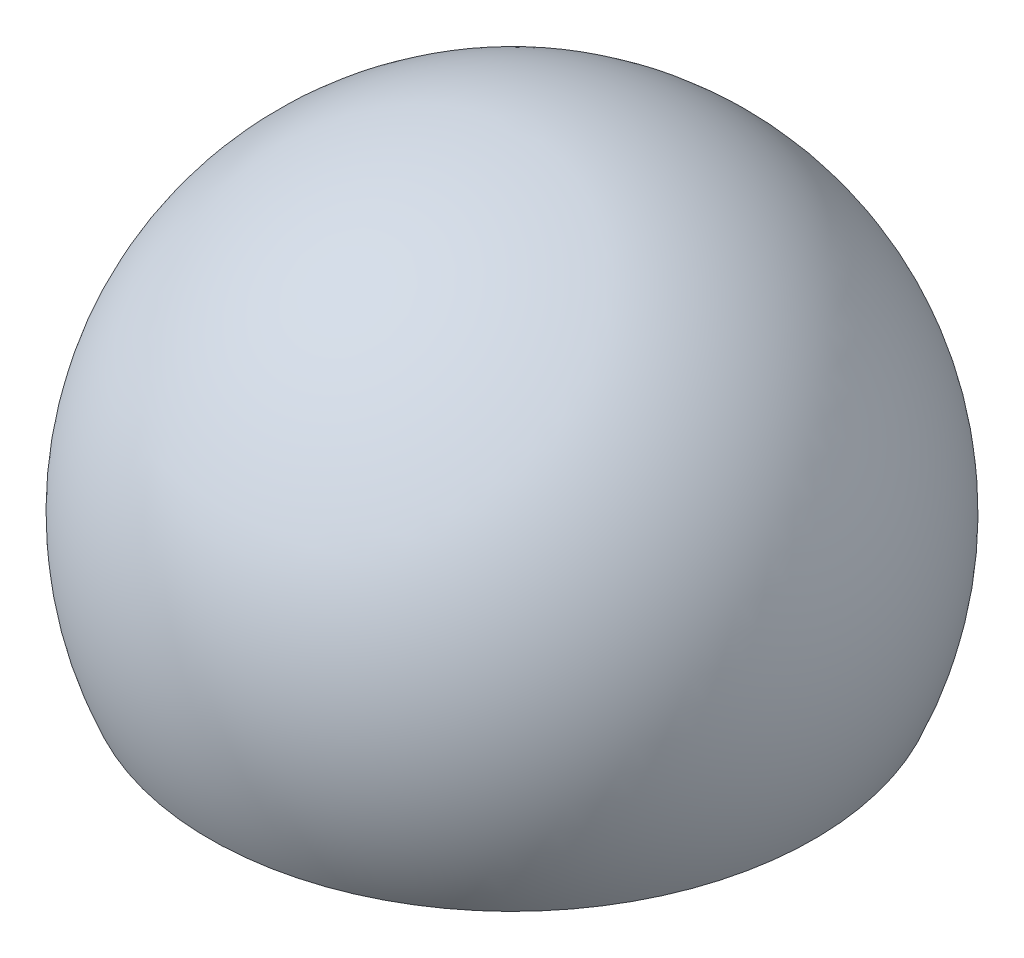
from build123d import *

# Parameters (mm, degrees)
SKETCH2_W           = 10.98
SKETCH2_H           = 10.98
BOSS_EXTRUDE1_DEPTH = 10
FILLET1_R           = 1


with BuildPart() as part:
    # Sketch2 → Boss-Extrude1 (new body)
    with BuildSketch(Plane(origin=(0, 0, 0), x_dir=(1, 0, 0), z_dir=(0, 1, 0))):
        Rectangle(SKETCH2_W, SKETCH2_H)
    extrude(amount=BOSS_EXTRUDE1_DEPTH)

    # Fillet1
    fillet1_edges = [part.edges().sort_by_distance(p)[0] for p in [
        (5.49, 5, 5.49),
        (-5.49, 5, 5.49),
        (-5.49, 5, -5.49),
        (5.49, 5, -5.49),
    ]]
    fillet(fillet1_edges, radius=FILLET1_R)

    # Sketch4 → Revolve1 (revolve)
    with BuildSketch(Plane(origin=(0, 0, 0), x_dir=(0, 0, -1), z_dir=(1, 0, 0))):
        with BuildLine():
            Line((22.912878475, 0), (11, 0))
            Line((11, 0), (11, 10))
            ThreePointArc((11, 10), (9.523392253, 15.504997729), (5.49, 19.53204595))
            Line((5.49, 19.53204595), (5.49, 10))
            Line((5.49, 10), (0, 10))
            Line((0, 10), (0, 35))
            ThreePointArc((0, 35), (20.916500663, 23.693063938), (22.912878475, 0))
        make_face()
    revolve(axis=Axis((0, 10, 0), (0, 1, 0)))


solid = part.part
